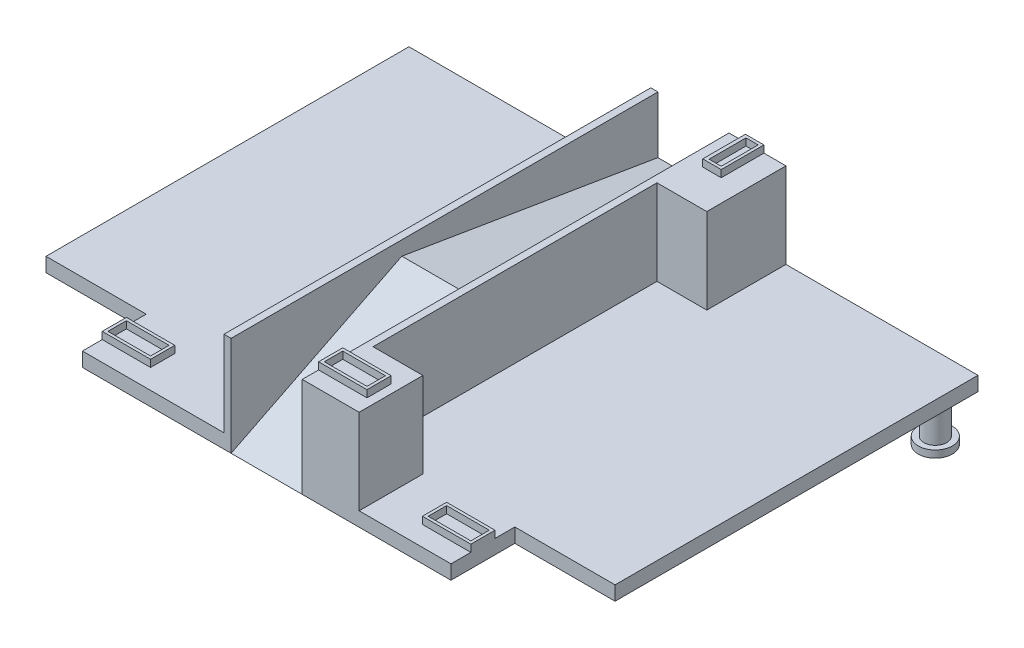
from build123d import *

# Parameters (mm, degrees)
BOSS_EXTRUDE3_DEPTH  = 10
SKETCH2_W            = 34
SKETCH2_H            = 17
SKETCH2_W_2          = 30
SKETCH2_H_2          = 13
BOSS_EXTRUDE4_DEPTH  = 5
SKETCH3_W            = 50
SKETCH3_H            = 120
BOSS_EXTRUDE5_DEPTH  = 50
CUT_EXTRUDE2_DEPTH   = 50
SKETCH5_W            = 50
SKETCH5_H            = 180
BOSS_EXTRUDE6_DEPTH  = 50
CUT_EXTRUDE3_DEPTH   = 346.480399988
SKETCH7_W            = 5
SKETCH7_H            = 300
BOSS_EXTRUDE7_DEPTH  = 70
SKETCH9_W            = 34
SKETCH9_H            = 17
SKETCH9_W_2          = 30
SKETCH9_H_2          = 13
BOSS_EXTRUDE8_DEPTH  = 5
SKETCH10_W           = 55.647662557
SKETCH10_H           = 60
BOSS_EXTRUDE9_DEPTH  = 35
SKETCH13_W           = 13
SKETCH13_H           = 30
SKETCH13_W_2         = 8.592805021
SKETCH13_H_2         = 26
BOSS_EXTRUDE11_DEPTH = 5
SKETCH14_R           = 8
BOSS_EXTRUDE12_DEPTH = 27
SKETCH16_R           = 8
BOSS_EXTRUDE13_DEPTH = 27
SKETCH17_R           = 12
BOSS_EXTRUDE14_DEPTH = 5
SKETCH18_R           = 12
BOSS_EXTRUDE15_DEPTH = 5


with BuildPart() as part:
    # Sketch1 → Boss-Extrude3 (new body)
    with BuildSketch(Plane(origin=(0, 0, 0), x_dir=(1, 0, 0), z_dir=(0, 1, 0))):
        Polygon((-100.4558, 255.209143206), (299.5442, 255.209143206), (299.5442, 0.092543206), (229.0884, 0.092543206), (229.0884, -44.790856794), (-30, -44.790856794), (-30, 0.092543206), (-100.4558, 0.092543206), align=None)
    extrude(amount=BOSS_EXTRUDE3_DEPTH)

    # Sketch2 → Boss-Extrude4 (add)
    # profile 1 of 2: a face of its own
    with BuildSketch(Plane(origin=(0, 10, 0), x_dir=(1, 0, 0), z_dir=(0, 1, 0))):
        with Locations((-13, -22.349156794)):
            Rectangle(SKETCH2_W, SKETCH2_H)
        with Locations((-13, -22.349156794)):
            Rectangle(SKETCH2_W_2, SKETCH2_H_2, mode=Mode.SUBTRACT)
    # profile 2 of 2: a face of its own
    with BuildSketch(Plane(origin=(0, 10, 0), x_dir=(1, 0, 0), z_dir=(0, 1, 0))):
        with Locations((212.0884, -22.349156794)):
            Rectangle(SKETCH2_W, SKETCH2_H)
        with Locations((212.0884, -22.349156794)):
            Rectangle(SKETCH2_W_2, SKETCH2_H_2, mode=Mode.SUBTRACT)
    extrude(amount=BOSS_EXTRUDE4_DEPTH)

    # Sketch3 → Boss-Extrude5 (add)
    with BuildSketch(Plane(origin=(0, 10, 0), x_dir=(1, 0, 0), z_dir=(0, 1, 0))):
        with Locations((99.5442, 15.209143206)):
            Rectangle(SKETCH3_W, SKETCH3_H)
    extrude(amount=BOSS_EXTRUDE5_DEPTH)

    # Sketch4 → Cut-Extrude2 (cut)
    with BuildSketch(Plane(origin=(124.5442, 0, 0), x_dir=(0, 0, -1), z_dir=(1, 0, 0))):
        Polygon((-44.790856794, 60), (75.209143206, 60), (-44.790856794, 0), align=None)
    extrude(amount=-CUT_EXTRUDE2_DEPTH, mode=Mode.SUBTRACT)

    # Sketch5 → Boss-Extrude6 (add)
    with BuildSketch(Plane(origin=(0, 10, 0), x_dir=(1, 0, 0), z_dir=(0, 1, 0))):
        with Locations((99.5442, 165.209143206)):
            Rectangle(SKETCH5_W, SKETCH5_H)
    extrude(amount=BOSS_EXTRUDE6_DEPTH)

    # Sketch6 → Cut-Extrude3 (cut, through all)
    with BuildSketch(Plane(origin=(124.5442, 0, 0), x_dir=(0, 0, -1), z_dir=(1, 0, 0))):
        Polygon((75.209143206, 60), (255.209143206, 60), (255.209143206, 30), align=None)
    extrude(amount=-CUT_EXTRUDE3_DEPTH, mode=Mode.SUBTRACT)

    # Sketch7 → Boss-Extrude7 (add)
    with BuildSketch(Plane(origin=(0, 0, 0), x_dir=(1, 0, 0), z_dir=(0, 1, 0))):
        with Locations((72.0442, 105.209143206)):
            Rectangle(SKETCH7_W, SKETCH7_H)
        Polygon((129.5442, 255.209143206), (124.5442, 255.209143206), (124.5442, -44.790856794), (164.5442, -44.790856794), (164.5442, 0), (129.5442, 0), align=None)
    extrude(amount=BOSS_EXTRUDE7_DEPTH)

    # Sketch9 → Boss-Extrude8 (add)
    with BuildSketch(Plane(origin=(0, 70, 0), x_dir=(1, 0, 0), z_dir=(0, 1, 0))):
        with Locations((141.5442, -24.790856794)):
            Rectangle(SKETCH9_W, SKETCH9_H)
        with Locations((141.5442, -24.790856794)):
            Rectangle(SKETCH9_W_2, SKETCH9_H_2, mode=Mode.SUBTRACT)
    extrude(amount=BOSS_EXTRUDE8_DEPTH)

    # Sketch10 → Boss-Extrude9 (add)
    with BuildSketch(Plane(origin=(129.5442, 0, 0), x_dir=(0, 0, -1), z_dir=(1, 0, 0))):
        with Locations((227.385311928, 40)):
            Rectangle(SKETCH10_W, SKETCH10_H)
    extrude(amount=BOSS_EXTRUDE9_DEPTH)

    # Sketch13 → Boss-Extrude11 (add)
    with BuildSketch(Plane(origin=(0, 70, 0), x_dir=(1, 0, 0), z_dir=(0, 1, 0))):
        with Locations((142.552716242, 240.209143206)):
            Rectangle(SKETCH13_W, SKETCH13_H)
        with Locations((142.756313732, 240.209143206)):
            Rectangle(SKETCH13_W_2, SKETCH13_H_2, mode=Mode.SUBTRACT)
    extrude(amount=BOSS_EXTRUDE11_DEPTH)

    # Sketch14 → Boss-Extrude12 (add)
    with BuildSketch(Plane.XZ):
        with Locations(Location((284.5442, -240.209143206, 0), (0, 0, 90))):
            Circle(SKETCH14_R)
    extrude(amount=BOSS_EXTRUDE12_DEPTH)

    # Sketch16 → Boss-Extrude13 (add)
    with BuildSketch(Plane.XZ):
        with Locations(Location((-85.4558, -240.209143206, 0), (0, 0, 90))):
            Circle(SKETCH16_R)
    extrude(amount=BOSS_EXTRUDE13_DEPTH)

    # Sketch17 → Boss-Extrude14 (add)
    with BuildSketch(Plane.XZ.offset(27)):
        with Locations(Location((284.5442, -240.209143206, 0), (0, 0, 270))):
            Circle(SKETCH17_R)
    extrude(amount=BOSS_EXTRUDE14_DEPTH)

    # Sketch18 → Boss-Extrude15 (add)
    with BuildSketch(Plane.XZ.offset(27)):
        with Locations(Location((-85.4558, -240.209143206, 0), (0, 0, 270))):
            Circle(SKETCH18_R)
    extrude(amount=BOSS_EXTRUDE15_DEPTH)


solid = part.part
